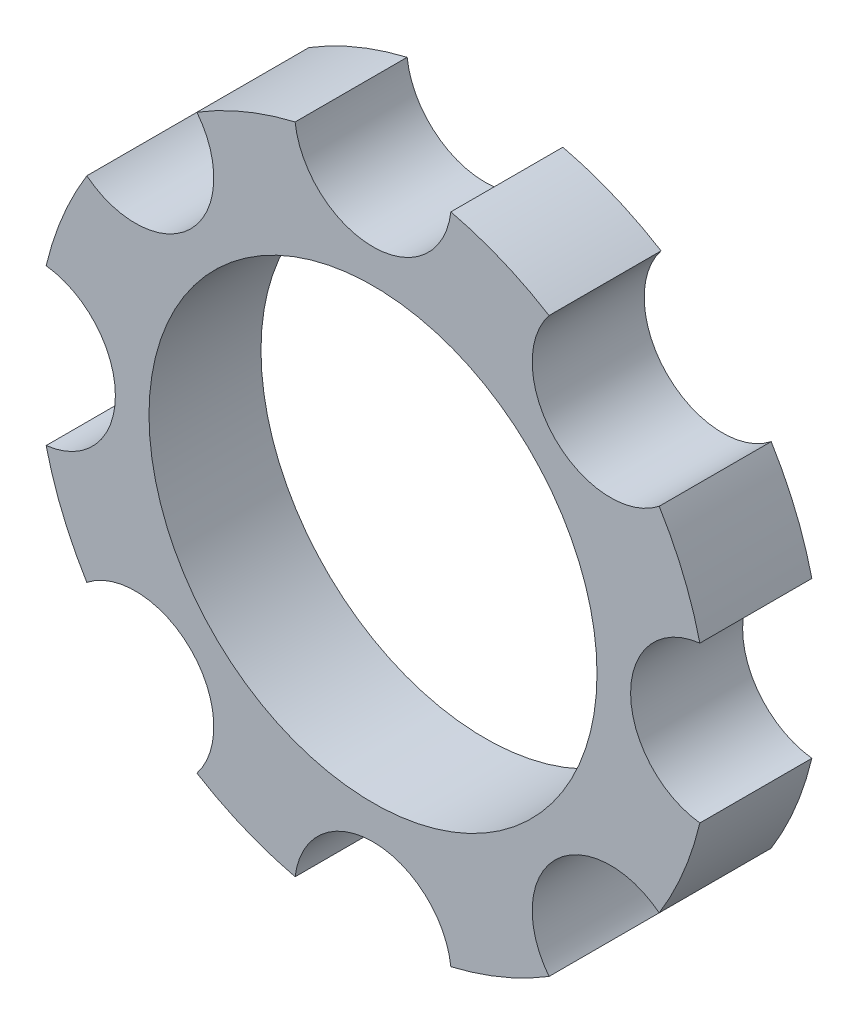
from build123d import *

# Parameters (mm, degrees)
SKETCH1_R           = 20
BOSS_EXTRUDE1_DEPTH = 10


with BuildPart() as part:
    # Sketch1 → Boss-Extrude1 (new body)
    with BuildSketch(Plane.XY):
        with BuildLine():
            ThreePointArc((-6.952197894, 29.183333333), (-11.480502971, 27.716385975), (-15.719786623, 25.551679173))
            ThreePointArc((-15.719786623, 25.551679173), (-16.263455967, 16.263455967), (-25.551679173, 15.719786623))
            ThreePointArc((-25.551679173, 15.719786623), (-27.716385975, 11.480502971), (-29.183333333, 6.952197894))
            ThreePointArc((-29.183333333, 6.952197894), (-23, 0), (-29.183333333, -6.952197894))
            ThreePointArc((-29.183333333, -6.952197894), (-27.716385975, -11.480502971), (-25.551679173, -15.719786623))
            ThreePointArc((-25.551679173, -15.719786623), (-16.263455967, -16.263455967), (-15.719786623, -25.551679173))
            ThreePointArc((-15.719786623, -25.551679173), (-11.480502971, -27.716385975), (-6.952197894, -29.183333333))
            ThreePointArc((-6.952197894, -29.183333333), (0, -23), (6.952197894, -29.183333333))
            ThreePointArc((6.952197894, -29.183333333), (11.480502971, -27.716385975), (15.719786623, -25.551679173))
            ThreePointArc((15.719786623, -25.551679173), (16.263455967, -16.263455967), (25.551679173, -15.719786623))
            ThreePointArc((25.551679173, -15.719786623), (27.716385975, -11.480502971), (29.183333333, -6.952197894))
            ThreePointArc((29.183333333, -6.952197894), (23, 0), (29.183333333, 6.952197894))
            ThreePointArc((29.183333333, 6.952197894), (27.716385975, 11.480502971), (25.551679173, 15.719786623))
            ThreePointArc((25.551679173, 15.719786623), (16.263455967, 16.263455967), (15.719786623, 25.551679173))
            ThreePointArc((15.719786623, 25.551679173), (11.480502971, 27.716385975), (6.952197894, 29.183333333))
            ThreePointArc((6.952197894, 29.183333333), (0, 23), (-6.952197894, 29.183333333))
        make_face()
        Circle(SKETCH1_R, mode=Mode.SUBTRACT)
    extrude(amount=BOSS_EXTRUDE1_DEPTH)


solid = part.part
